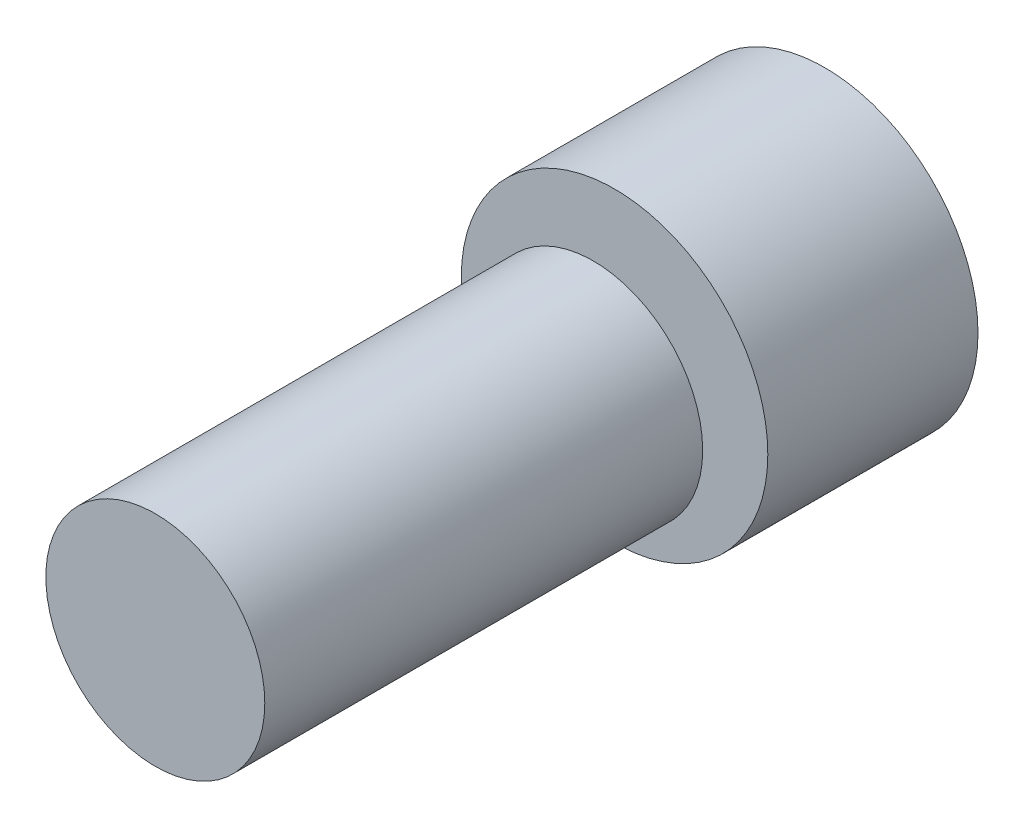
from build123d import *

# Parameters (mm, degrees)
SKETCH1_R           = 3.5
BOSS_EXTRUDE1_DEPTH = 4.8
SKETCH1_3_R         = 2.5
BOSS_EXTRUDE2_DEPTH = 14.8


with BuildPart() as part:
    # Sketch1 → Boss-Extrude1 (new body)
    with BuildSketch(Plane.XY):
        with Locations((2.06728972, 2.824236749)):
            Circle(SKETCH1_R)
    extrude(amount=BOSS_EXTRUDE1_DEPTH)

    # Sketch1<3> → Boss-Extrude2 (add)
    with BuildSketch(Plane.XY):
        with Locations((1.58, 2.158523801)):
            Circle(SKETCH1_3_R)
    extrude(amount=BOSS_EXTRUDE2_DEPTH)


solid = part.part
